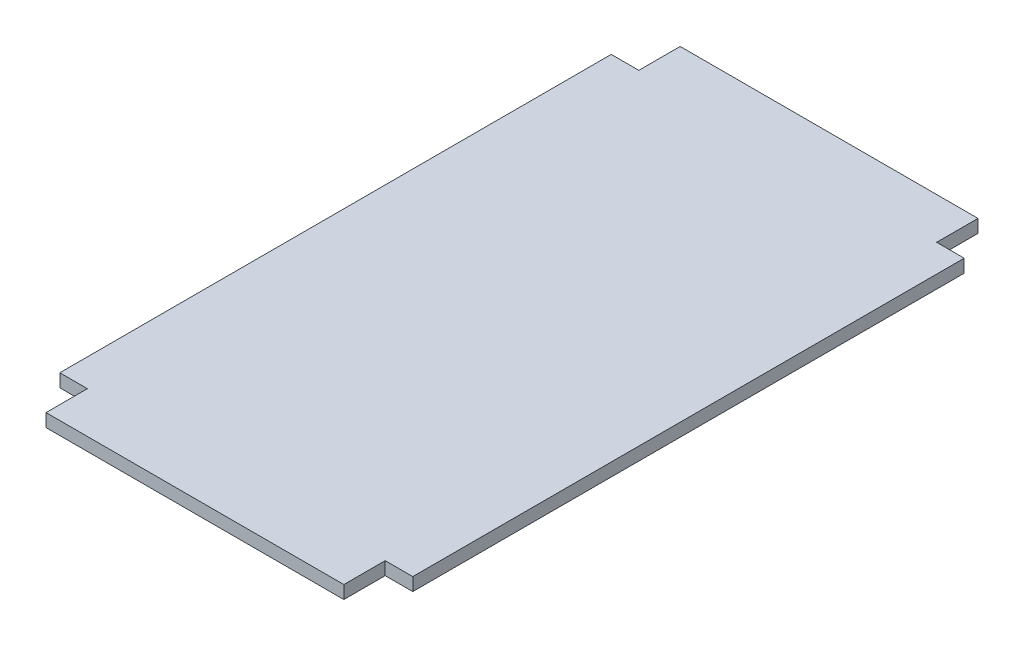
from build123d import *

# Parameters (mm, degrees)
BOSS_EXTRUDE1_DEPTH = 2.9972


with BuildPart() as part:
    # Sketch1 → Boss-Extrude1 (new body)
    with BuildSketch(Plane(origin=(0, 0, 0), x_dir=(1, 0, 0), z_dir=(0, 1, 0))):
        Polygon((-34.2971374, -73.025), (34.2971374, -73.025), (34.2971374, -63.5), (40.6471374, -63.5), (40.6471374, 63.5), (34.2971374, 63.5), (34.2971374, 73.025), (-34.2971374, 73.025), (-34.2971374, 63.5), (-40.6471374, 63.5), (-40.6471374, -63.5), (-34.2971374, -63.5), align=None)
    extrude(amount=BOSS_EXTRUDE1_DEPTH)


solid = part.part
